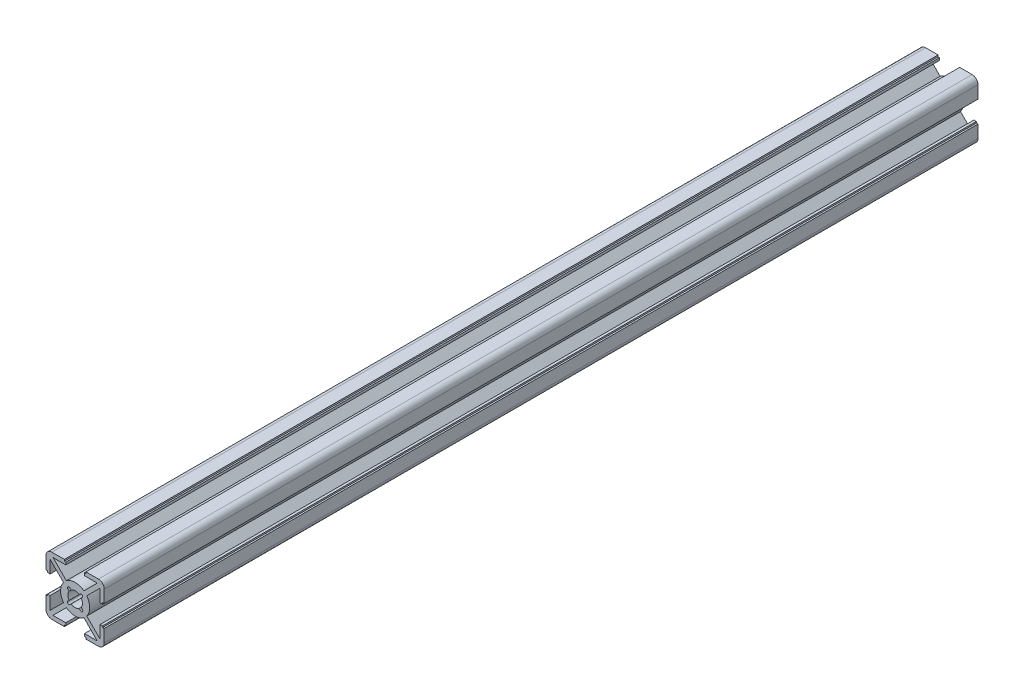
from build123d import *

# Parameters (mm, degrees)
Y_KSEKLIK_EKSTR_ZYON1_DEPTH = 300


with BuildPart() as part:
    # Çizim1 → Yükseklik-Ekstrüzyon1 (new body)
    with BuildSketch(Plane.XY):
        with BuildLine():
            Line((8.6, 7.610050506), (8.6, 3.2))
            Line((8.6, 3.2), (9.44, 3.2))
            Line((9.44, 3.2), (9.44, 3.7))
            Line((9.44, 3.7), (10, 3.7))
            Line((10, 3.7), (10, 8))
            ThreePointArc((10, 8), (9.414213562, 9.414213562), (8, 10))
            Line((8, 10), (3.7, 10))
            Line((3.7, 10), (3.7, 9.44))
            Line((3.7, 9.44), (3.2, 9.44))
            Line((3.2, 9.44), (3.2, 8.6))
            Line((3.2, 8.6), (7.610050506, 8.6))
            Line((7.610050506, 8.6), (3.005739466, 3.99568896))
            ThreePointArc((3.005739466, 3.99568896), (0, 5), (-3.005739466, 3.99568896))
            Line((-3.005739466, 3.99568896), (-7.610050506, 8.6))
            Line((-7.610050506, 8.6), (-3.2, 8.6))
            Line((-3.2, 8.6), (-3.2, 9.44))
            Line((-3.2, 9.44), (-3.7, 9.44))
            Line((-3.7, 9.44), (-3.7, 10))
            Line((-3.7, 10), (-8, 10))
            ThreePointArc((-8, 10), (-9.414213562, 9.414213562), (-10, 8))
            Line((-10, 8), (-10, 3.7))
            Line((-10, 3.7), (-9.44, 3.7))
            Line((-9.44, 3.7), (-9.44, 3.2))
            Line((-9.44, 3.2), (-8.6, 3.2))
            Line((-8.6, 3.2), (-8.6, 7.610050506))
            Line((-8.6, 7.610050506), (-3.99568896, 3.005739466))
            ThreePointArc((-3.99568896, 3.005739466), (-5, 0), (-3.99568896, -3.005739466))
            Line((-3.99568896, -3.005739466), (-8.6, -7.610050506))
            Line((-8.6, -7.610050506), (-8.6, -3.2))
            Line((-8.6, -3.2), (-9.44, -3.2))
            Line((-9.44, -3.2), (-9.44, -3.7))
            Line((-9.44, -3.7), (-10, -3.7))
            Line((-10, -3.7), (-10, -8))
            ThreePointArc((-10, -8), (-9.414213562, -9.414213562), (-8, -10))
            Line((-8, -10), (-3.7, -10))
            Line((-3.7, -10), (-3.7, -9.44))
            Line((-3.7, -9.44), (-3.2, -9.44))
            Line((-3.2, -9.44), (-3.2, -8.6))
            Line((-3.2, -8.6), (-7.610050506, -8.6))
            Line((-7.610050506, -8.6), (-3.005739466, -3.99568896))
            ThreePointArc((-3.005739466, -3.99568896), (0, -5), (3.005739466, -3.99568896))
            Line((3.005739466, -3.99568896), (7.610050506, -8.6))
            Line((7.610050506, -8.6), (3.2, -8.6))
            Line((3.2, -8.6), (3.2, -9.44))
            Line((3.2, -9.44), (3.7, -9.44))
            Line((3.7, -9.44), (3.7, -10))
            Line((3.7, -10), (8, -10))
            ThreePointArc((8, -10), (9.414213562, -9.414213562), (10, -8))
            Line((10, -8), (10, -3.7))
            Line((10, -3.7), (9.44, -3.7))
            Line((9.44, -3.7), (9.44, -3.2))
            Line((9.44, -3.2), (8.6, -3.2))
            Line((8.6, -3.2), (8.6, -7.610050506))
            Line((8.6, -7.610050506), (3.99568896, -3.005739466))
            ThreePointArc((3.99568896, -3.005739466), (5, 0), (3.99568896, 3.005739466))
            Line((3.99568896, 3.005739466), (8.6, 7.610050506))
        make_face()
        with BuildLine():
            Line((2.474873734, 1.767766953), (2.085604198, 1.378497417))
            ThreePointArc((2.085604198, 1.378497417), (2.5, 0), (2.085604198, -1.378497417))
            Line((2.085604198, -1.378497417), (2.474873734, -1.767766953))
            ThreePointArc((2.474873734, -1.767766953), (2.474873734, -2.474873734), (1.767766953, -2.474873734))
            Line((1.767766953, -2.474873734), (1.378497417, -2.085604198))
            ThreePointArc((1.378497417, -2.085604198), (0, -2.5), (-1.378497417, -2.085604198))
            Line((-1.378497417, -2.085604198), (-1.767766953, -2.474873734))
            ThreePointArc((-1.767766953, -2.474873734), (-2.474873734, -2.474873734), (-2.474873734, -1.767766953))
            Line((-2.474873734, -1.767766953), (-2.085604198, -1.378497417))
            ThreePointArc((-2.085604198, -1.378497417), (-2.5, 0), (-2.085604198, 1.378497417))
            Line((-2.085604198, 1.378497417), (-2.474873734, 1.767766953))
            ThreePointArc((-2.474873734, 1.767766953), (-2.474873734, 2.474873734), (-1.767766953, 2.474873734))
            Line((-1.767766953, 2.474873734), (-1.378497417, 2.085604198))
            ThreePointArc((-1.378497417, 2.085604198), (0, 2.5), (1.378497417, 2.085604198))
            Line((1.378497417, 2.085604198), (1.767766953, 2.474873734))
            ThreePointArc((1.767766953, 2.474873734), (2.474873734, 2.474873734), (2.474873734, 1.767766953))
        make_face(mode=Mode.SUBTRACT)
    extrude(amount=Y_KSEKLIK_EKSTR_ZYON1_DEPTH)


solid = part.part
